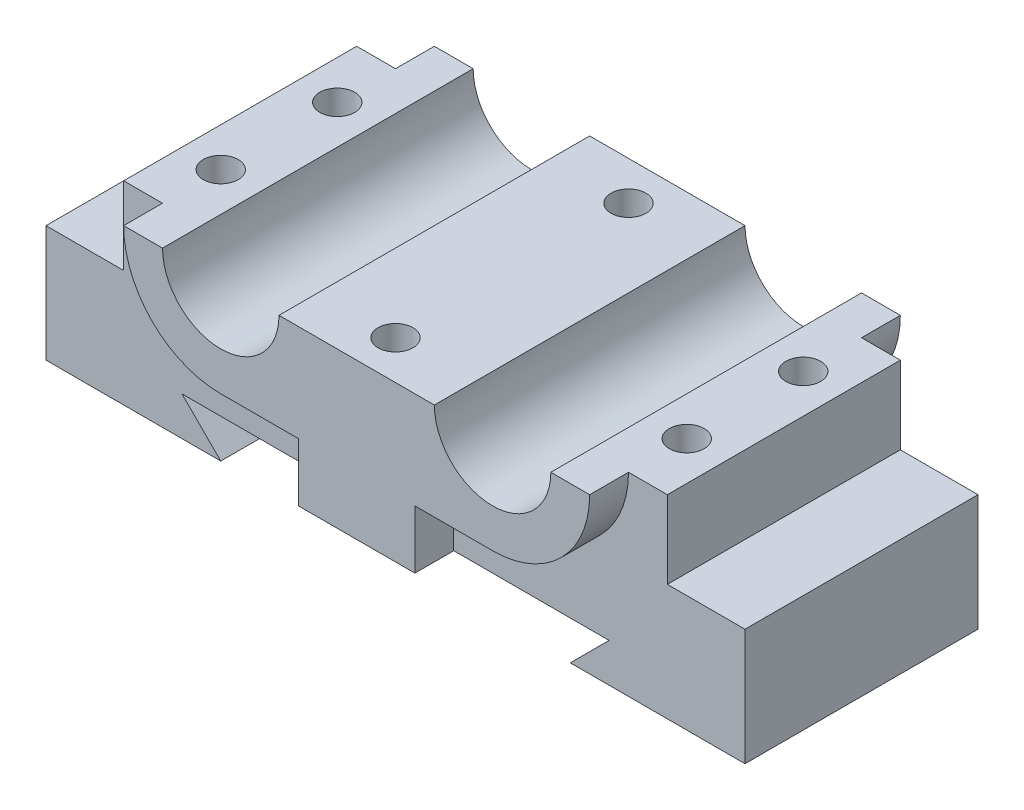
from build123d import *

# Parameters (mm, degrees)
BOSS_EXTRUDE1_DEPTH   = 5
BOSS_EXTRUDE2_START   = -15
BOSS_EXTRUDE2_DEPTH   = 15
F_1_0MM_DOWEL_HOLE1_D = 4.5
SKETCH5_R             = 2.25
CUT_EXTRUDE1_DEPTH    = 81.039052968


with BuildPart() as part:
    # Sketch1 → Boss-Extrude1 (new body)
    with BuildSketch(Plane.XY):
        with BuildLine():
            Line((22.5, 25), (22.5, 5))
            Line((22.5, 5), (30, 5))
            Line((30, 5), (30, 12.5))
            Line((30, 12.5), (40, 12.5))
            ThreePointArc((40, 12.5), (48.838834765, 16.161165235), (52.5, 25))
            Line((52.5, 25), (47.5, 25))
            ThreePointArc((47.5, 25), (40, 17.5), (32.5, 25))
            Line((32.5, 25), (22.5, 25))
        make_face()
        with BuildLine():
            Line((15, 12.5), (15, 5))
            Line((15, 5), (22.5, 5))
            Line((22.5, 5), (22.5, 25))
            Line((22.5, 25), (12.5, 25))
            ThreePointArc((12.5, 25), (5, 17.5), (-2.5, 25))
            Line((-2.5, 25), (-7.5, 25))
            ThreePointArc((-7.5, 25), (-3.838834765, 16.161165235), (5, 12.5))
            Line((5, 12.5), (15, 12.5))
        make_face()
    extrude(amount=BOSS_EXTRUDE1_DEPTH)

    # Sketch1<3> → Boss-Extrude2 (add)
    with BuildSketch(Plane.XY.offset(BOSS_EXTRUDE2_START)):
        with BuildLine():
            Line((30, 12.5), (30, 5))
            Line((30, 5), (50, 5))
            Line((50, 5), (45, 0))
            Line((45, 0), (67.5, 0))
            Line((67.5, 0), (67.5, 15))
            Line((67.5, 15), (57.5, 15))
            Line((57.5, 15), (57.5, 25))
            Line((57.5, 25), (52.5, 25))
            ThreePointArc((52.5, 25), (48.838834765, 16.161165235), (40, 12.5))
            Line((40, 12.5), (30, 12.5))
        make_face()
        with BuildLine():
            Line((-22.5, 0), (0, 0))
            Line((0, 0), (-5, 5))
            Line((-5, 5), (15, 5))
            Line((15, 5), (15, 12.5))
            Line((15, 12.5), (5, 12.5))
            ThreePointArc((5, 12.5), (-3.838834765, 16.161165235), (-7.5, 25))
            Line((-7.5, 25), (-12.5, 25))
            Line((-12.5, 25), (-12.5, 15))
            Line((-12.5, 15), (-22.5, 15))
            Line((-22.5, 15), (-22.5, 0))
        make_face()
        with BuildLine():
            Line((15, 12.5), (15, 5))
            Line((15, 5), (22.5, 5))
            Line((22.5, 5), (22.5, 25))
            Line((22.5, 25), (12.5, 25))
            ThreePointArc((12.5, 25), (5, 17.5), (-2.5, 25))
            Line((-2.5, 25), (-7.5, 25))
            ThreePointArc((-7.5, 25), (-3.838834765, 16.161165235), (5, 12.5))
            Line((5, 12.5), (15, 12.5))
        make_face()
        with BuildLine():
            Line((22.5, 25), (22.5, 5))
            Line((22.5, 5), (30, 5))
            Line((30, 5), (30, 12.5))
            Line((30, 12.5), (40, 12.5))
            ThreePointArc((40, 12.5), (48.838834765, 16.161165235), (52.5, 25))
            Line((52.5, 25), (47.5, 25))
            ThreePointArc((47.5, 25), (40, 17.5), (32.5, 25))
            Line((32.5, 25), (22.5, 25))
        make_face()
    extrude(amount=BOSS_EXTRUDE2_DEPTH)

    # Mirror1: part across plane


with BuildPart() as part_1:
    add(part.part)
    add(part.part.mirror(Plane(origin=(0, 0, -15), x_dir=(1, 0, 0), z_dir=(0, 0, -1))))

    # Ø1.0mm Dowel Hole1 (through all)
    with Locations(Plane(origin=(-7.5, 25, -7.5), x_dir=(1, 0, 0), z_dir=(0, 1, 0))):
        with Locations((0, 0), (60, 15), (60, 0), (0, 15)):
            Hole(F_1_0MM_DOWEL_HOLE1_D / 2)

    # Sketch5 → Cut-Extrude1 (cut, through all)
    with BuildSketch(Plane(origin=(0, 25, 0), x_dir=(1, 0, 0), z_dir=(0, 1, 0))):
        with Locations(Location((22.5, 30, 0), (0, 0, 180))):
            Circle(SKETCH5_R)
        with Locations(Location((22.5, 0, 0), (0, 0, 180))):
            Circle(SKETCH5_R)
    extrude(amount=-CUT_EXTRUDE1_DEPTH, mode=Mode.SUBTRACT)


solid = part_1.part
